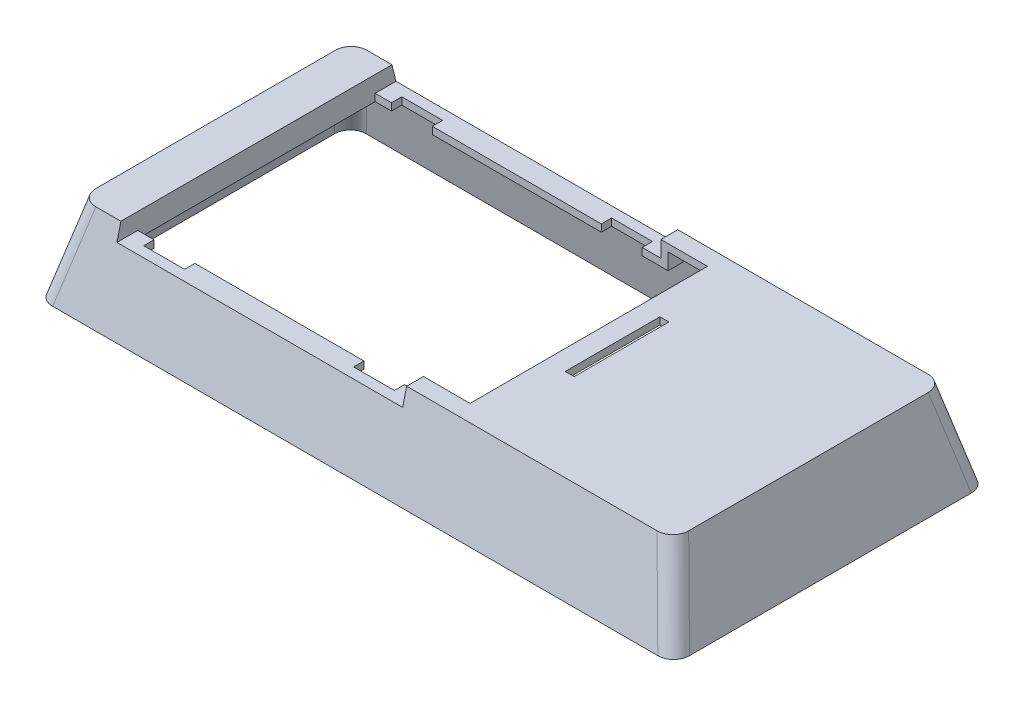
from build123d import *

# Parameters (mm, degrees)
CUT_EXTRUDE1_REACH             = 265.708
SKETCH4_W                      = 175
SKETCH4_H                      = 10
CUT_EXTRUDE1_DIRECTION_2_REACH = 265.708
SHELL1_T                       = -4.4
CUT_EXTRUDE2_DEPTH             = 224.718573366
FILLET1_R                      = 10
SKETCH7_W                      = 5.5
SKETCH7_H                      = 58
CUT_EXTRUDE4_DEPTH             = 10


with BuildPart() as part:
    # Sketch2 → Loft1 section 0
    with BuildSketch(Plane(origin=(0, 0, 0), x_dir=(1, 0, 0), z_dir=(0, 1, 0))):
        with BuildLine():
            Line((-195, 96), (195, 96))
            Line((195, 96), (195, -96))
            Line((195, -96), (-195, -96))
            Line((-195, -96), (-195, 96))
        make_face()
    # Sketch3 → Loft1 section 1
    with BuildSketch(Plane(origin=(0, 53, 0), x_dir=(1, 0, 0), z_dir=(0, 1, 0))):
        with BuildLine():
            Line((-181.5, 83), (181.5, 83))
            Line((181.5, 83), (181.5, -83))
            Line((181.5, -83), (-181.5, -83))
            Line((-181.5, -83), (-181.5, 83))
        make_face()
    loft()

    # Cut-Extrude1: up to this plane
    cut_extrude1_end = Plane(origin=(0, 22.210879785, -90.552048355), z_dir=(0, -0.23822152779764819, 0.9712108440981054))
    # Sketch4 → Cut-Extrude1 (cut, up to the surface)
    with BuildSketch(Plane.XY, mode=Mode.PRIVATE) as cut_extrude1_sk1:
        with Locations((-69, 48)):
            Rectangle(SKETCH4_W, SKETCH4_H)
    cut_extrude1_tool1 = split(extrude(cut_extrude1_sk1.sketch, amount=-CUT_EXTRUDE1_REACH, mode=Mode.PRIVATE), bisect_by=cut_extrude1_end, keep=Keep.BOTH, mode=Mode.PRIVATE)
    add(cut_extrude1_tool1.solids().sort_by_distance((-69, 48, 0))[0], mode=Mode.SUBTRACT)

    # Cut-Extrude1 direction 2: up to this plane
    cut_extrude1_direction_2_end = Plane(origin=(0, 22.210879785, 90.552048355), z_dir=(0, -0.23822152779764863, -0.9712108440981052))
    # Sketch4 → Cut-Extrude1 direction 2 (cut, up to the surface)
    with BuildSketch(Plane.XY, mode=Mode.PRIVATE) as cut_extrude1_direction_2_sk1:
        with Locations((-69, 48)):
            Rectangle(SKETCH4_W, SKETCH4_H)
    cut_extrude1_direction_2_tool1 = split(extrude(cut_extrude1_direction_2_sk1.sketch, amount=CUT_EXTRUDE1_DIRECTION_2_REACH, mode=Mode.PRIVATE), bisect_by=cut_extrude1_direction_2_end, keep=Keep.BOTH, mode=Mode.PRIVATE)
    add(cut_extrude1_direction_2_tool1.solids().sort_by_distance((-69, 48, 0))[0], mode=Mode.SUBTRACT)

    # Shell1
    shell1_openings = [part.faces().sort_by_distance(p)[0] for p in [
        (0, 0, 0),
    ]]
    offset(amount=SHELL1_T, openings=shell1_openings, kind=Kind.INTERSECTION)

    # Sketch5 → Cut-Extrude2 (cut, through all)
    with BuildSketch(Plane(origin=(0, 53, 0), x_dir=(1, 0, 0), z_dir=(0, 1, 0))):
        Polygon((47, -72.7), (47, 72.7), (7, 72.7), (7, 79), (-18, 79), (-18, 72.7), (-121.5, 72.7), (-121.5, 79), (-146.5, 79), (-146.5, 72.7), (-156.5, 72.7), (-156.5, -72.7), (-146.5, -72.7), (-146.5, -79), (-121.5, -79), (-121.5, -72.7), (-18, -72.7), (-18, -79), (7, -79), (7, -72.7), align=None)
    extrude(amount=-CUT_EXTRUDE2_DEPTH, mode=Mode.SUBTRACT)

    # Fillet1
    fillet1_edges = [part.edges().sort_by_distance(p)[0] for p in [
        (-188.25, 26.5, 89.5),
        (-188.25, 26.5, -89.5),
        (188.25, 26.5, 89.5),
        (188.25, 26.5, -89.5),
        (-184.269882767, 24.3, -85.509195467),
        (-184.269882767, 24.3, 85.509195467),
        (184.269882767, 24.3, 85.509195467),
        (184.269882767, 24.3, -85.509195467),
    ]]
    fillet(fillet1_edges, radius=FILLET1_R)

    # Sketch7 → Cut-Extrude4 (cut)
    with BuildSketch(Plane(origin=(0, 53, 0), x_dir=(1, 0, 0), z_dir=(0, 1, 0))):
        with Locations((61.95, 2.369883227)):
            Rectangle(SKETCH7_W, SKETCH7_H)
    extrude(amount=-CUT_EXTRUDE4_DEPTH, mode=Mode.SUBTRACT)


solid = part.part
